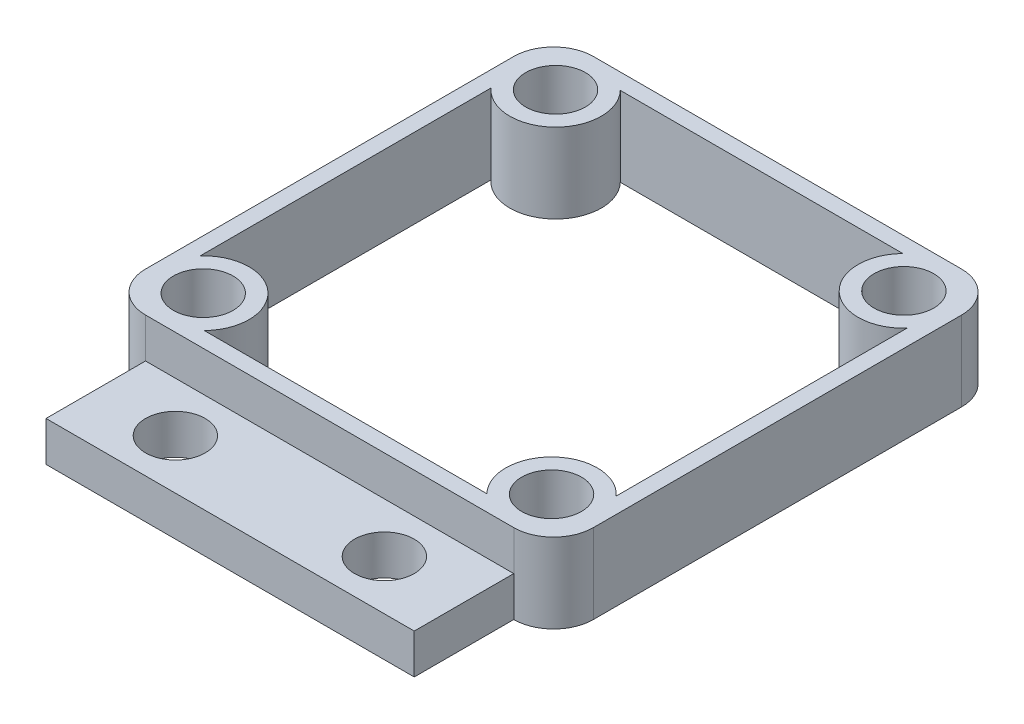
from build123d import *

# Parameters (mm, degrees)
SKETCH1_R           = 1.5
BOSS_EXTRUDE1_DEPTH = 4
SKETCH2_W           = 18.5
SKETCH2_H           = 2
BOSS_EXTRUDE2_DEPTH = 5
SKETCH3_R           = 1.5
CUT_EXTRUDE1_DEPTH  = 5


with BuildPart() as part:
    # Sketch1 → Boss-Extrude1 (new body)
    with BuildSketch(Plane(origin=(0, 0, 0), x_dir=(1, 0, 0), z_dir=(0, 1, 0))):
        with BuildLine():
            Line((-9.25, 11.25), (9.25, 11.25))
            ThreePointArc((9.25, 11.25), (10.664213562, 10.664213562), (11.25, 9.25))
            Line((11.25, 9.25), (11.25, -9.25))
            ThreePointArc((11.25, -9.25), (10.664213562, -10.664213562), (9.25, -11.25))
            Line((9.25, -11.25), (-9.25, -11.25))
            ThreePointArc((-9.25, -11.25), (-10.664213562, -10.664213562), (-11.25, -9.25))
            Line((-11.25, -9.25), (-11.25, 9.25))
            ThreePointArc((-11.25, 9.25), (-10.664213562, 10.664213562), (-9.25, 11.25))
        make_face()
        with Locations(Location((8.75, 8.85, 0), (0, 0, 270))):
            Circle(SKETCH1_R, mode=Mode.SUBTRACT)
        with Locations(Location((8.75, -8.85, 0), (0, 0, 90))):
            Circle(SKETCH1_R, mode=Mode.SUBTRACT)
        with Locations(Location((-8.75, 8.85, 0), (0, 0, 90))):
            Circle(SKETCH1_R, mode=Mode.SUBTRACT)
        with Locations(Location((-8.75, -8.85, 0), (0, 0, 270))):
            Circle(SKETCH1_R, mode=Mode.SUBTRACT)
        with BuildLine():
            Line((-7.097728836, 10.45), (7.097728836, 10.45))
            ThreePointArc((7.097728836, 10.45), (7.175222498, 7.173671924), (10.45, 7.300806662))
            Line((10.45, 7.300806662), (10.45, -7.300806662))
            ThreePointArc((10.45, -7.300806662), (7.175222498, -7.173671924), (7.097728836, -10.45))
            Line((7.097728836, -10.45), (-7.097728836, -10.45))
            ThreePointArc((-7.097728836, -10.45), (-7.175222498, -7.173671924), (-10.45, -7.300806662))
            Line((-10.45, -7.300806662), (-10.45, 7.300806662))
            ThreePointArc((-10.45, 7.300806662), (-7.175222498, 7.173671924), (-7.097728836, 10.45))
        make_face(mode=Mode.SUBTRACT)
    extrude(amount=BOSS_EXTRUDE1_DEPTH)

    # Sketch2 → Boss-Extrude2 (add)
    with BuildSketch(Plane.XY.offset(11.25)):
        with Locations((0, 1)):
            Rectangle(SKETCH2_W, SKETCH2_H)
    extrude(amount=BOSS_EXTRUDE2_DEPTH)

    # Sketch3 → Cut-Extrude1 (cut)
    with BuildSketch(Plane(origin=(0, 2, 0), x_dir=(1, 0, 0), z_dir=(0, 1, 0))):
        with Locations(Location((5.25, -13.75, 0), (0, 0, 270))):
            Circle(SKETCH3_R)
        with Locations(Location((-5.25, -13.75, 0), (0, 0, 90))):
            Circle(SKETCH3_R)
    extrude(amount=-CUT_EXTRUDE1_DEPTH, mode=Mode.SUBTRACT)


solid = part.part
